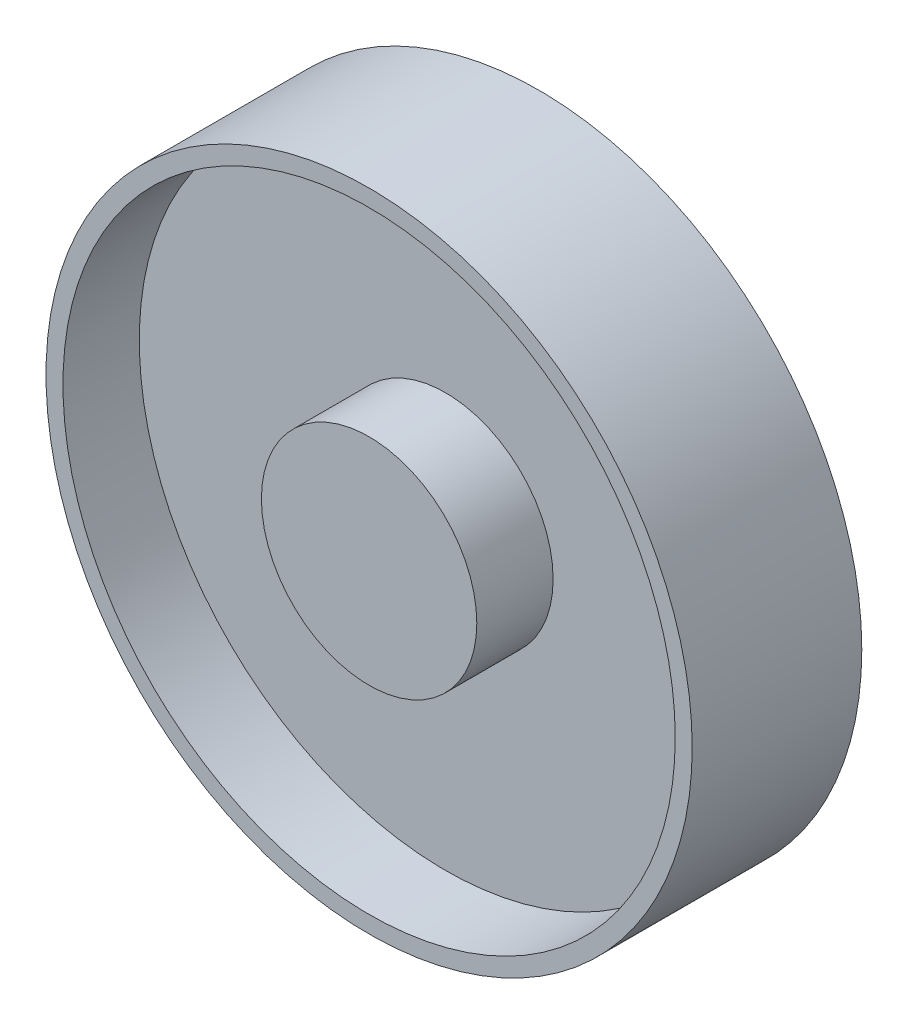
from build123d import *

# Parameters (mm, degrees)
SKETCH1_R           = 18.05
SKETCH1_R_2         = 6.35
BOSS_EXTRUDE1_DEPTH = 0.5
SKETCH1_3_R         = 19.05
SKETCH1_3_R_2       = 18.05
SKETCH1_3_R_3       = 6.35
BOSS_EXTRUDE2_DEPTH = 5


with BuildPart() as part:
    # Sketch1 → Boss-Extrude1 (new, symmetric)
    with BuildSketch(Plane.XY):
        Circle(SKETCH1_R)
        Circle(SKETCH1_R_2, mode=Mode.SUBTRACT)
    extrude(amount=BOSS_EXTRUDE1_DEPTH, both=True)

    # Sketch1<3> → Boss-Extrude2 (add, symmetric)
    # profile 1 of 2: a face of its own
    with BuildSketch(Plane.XY):
        Circle(SKETCH1_3_R)
        Circle(SKETCH1_3_R_2, mode=Mode.SUBTRACT)
    # profile 2 of 2: a face of its own
    with BuildSketch(Plane.XY):
        Circle(SKETCH1_3_R_3)
    extrude(amount=BOSS_EXTRUDE2_DEPTH, both=True)


solid = part.part
